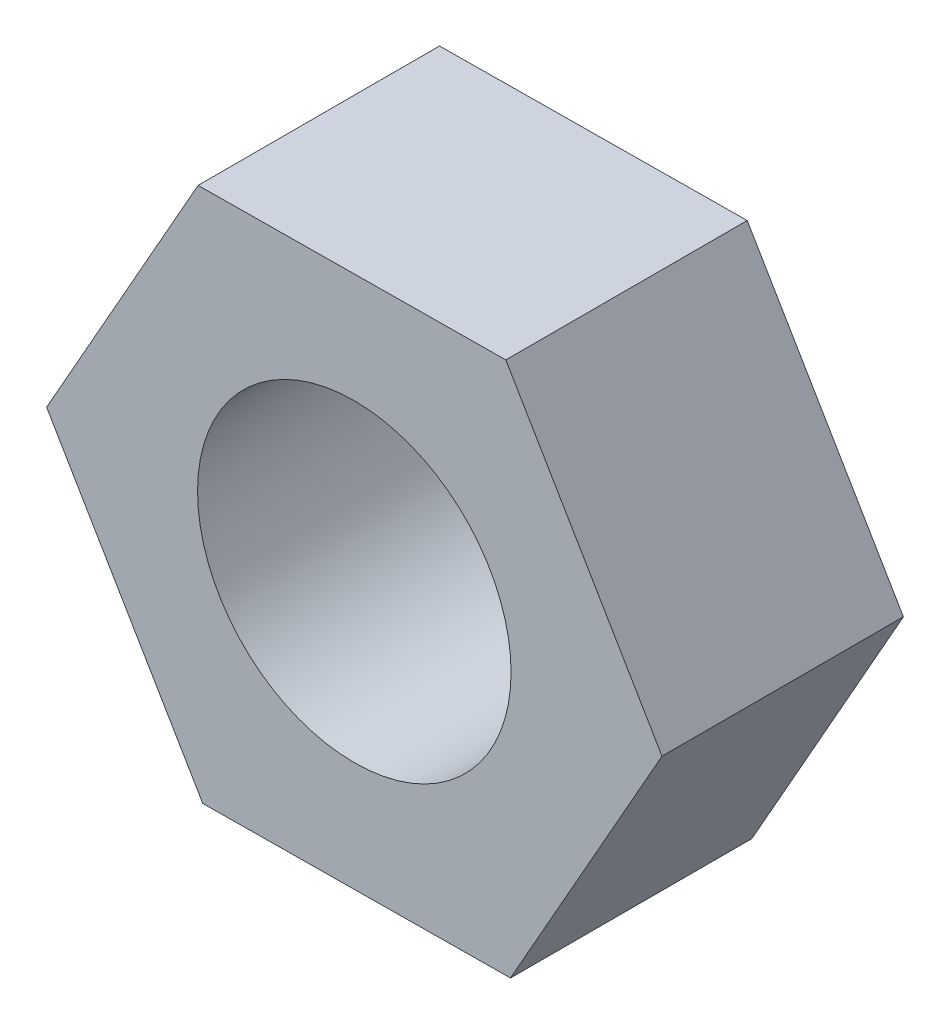
from build123d import *

# Parameters (mm, degrees)
SKETCH_1_R      = 5
EXTRUDE_1_DEPTH = 7.7


with BuildPart() as part:
    # 草图1 → 凸台-拉伸1 (new body)
    with BuildSketch(Plane.XY):
        Polygon((4.98210803, -8.456472841), (9.814574322, 0.086395698), (4.832466291, 8.542868539), (-4.98210803, 8.456472841), (-9.814574322, -0.086395698), (-4.832466291, -8.542868539), align=None)
        with Locations(Location((0, 0, 0), (0, 0, 180))):
            Circle(SKETCH_1_R, mode=Mode.SUBTRACT)
    extrude(amount=EXTRUDE_1_DEPTH)


solid = part.part
